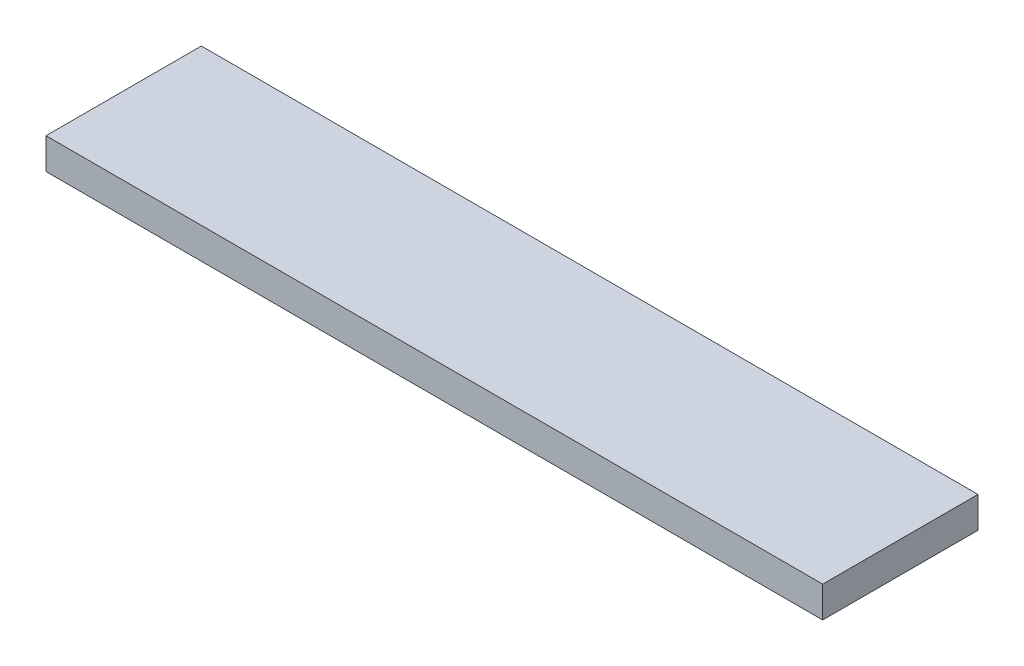
from build123d import *

# Parameters (mm, degrees)
SKETCH1_W           = 250
SKETCH1_H           = 50
BOSS_EXTRUDE1_DEPTH = 10


with BuildPart() as part:
    # Sketch1 → Boss-Extrude1 (new body)
    with BuildSketch(Plane(origin=(0, 0, 0), x_dir=(1, 0, 0), z_dir=(0, 1, 0))):
        with Locations((125, 25)):
            Rectangle(SKETCH1_W, SKETCH1_H)
    extrude(amount=BOSS_EXTRUDE1_DEPTH)


solid = part.part
